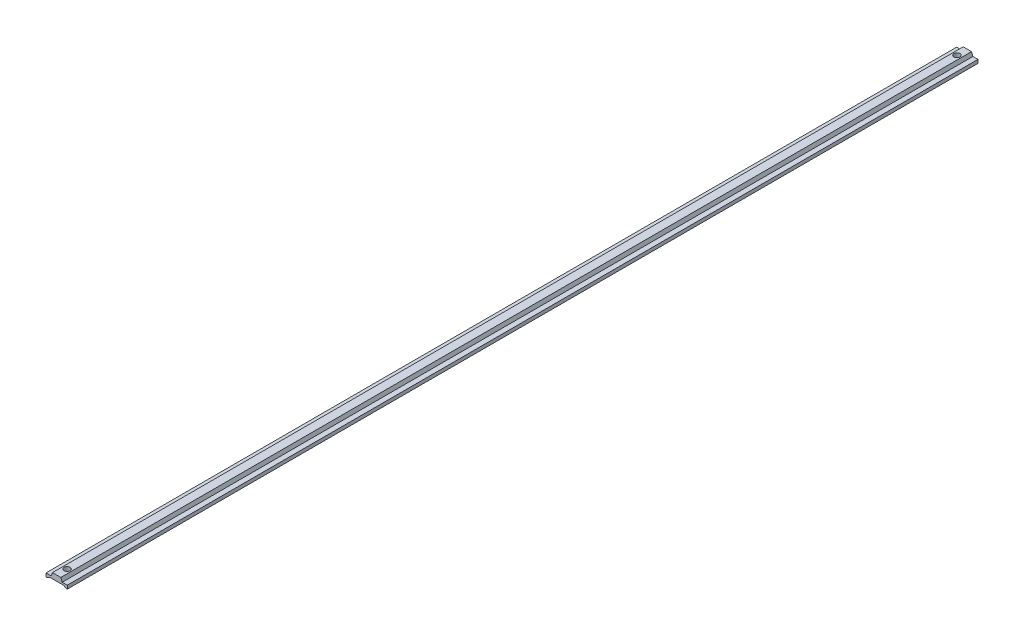
from build123d import *

# Parameters (mm, degrees)
EXTRUDE_1_DEPTH     = 655
SKETCH_2_R          = 2.15
CUT_EXTRUDE_1_DEPTH = 3.9


with BuildPart() as part:
    # ｽｹｯﾁ1 → ﾎﾞｽ - 押し出し1 (new body)
    with BuildSketch(Plane.XY):
        Polygon((4, -2.5), (3, 0), (0, 0), (0, -3.9), (5.05, -3.9), (6.65, -5), (7.65, -5), (7.65, -2.5), align=None)
        Polygon((0, -3.9), (0, 0), (-3, 0), (-4, -2.5), (-7.65, -2.5), (-7.65, -5), (-6.65, -5), (-5.05, -3.9), align=None)
    extrude(amount=EXTRUDE_1_DEPTH)

    # ｽｹｯﾁ2 → ｶｯﾄ - 押し出し1 (cut)
    with BuildSketch(Plane(origin=(0, 0, 0), x_dir=(1, 0, 0), z_dir=(0, 1, 0))):
        with Locations(Location((0, -7.5, 0), (0, 0, 270))):
            Circle(SKETCH_2_R)
        with Locations(Location((0, -647.5, 0), (0, 0, 270))):
            Circle(SKETCH_2_R)
    extrude(amount=-CUT_EXTRUDE_1_DEPTH, mode=Mode.SUBTRACT)


solid = part.part
